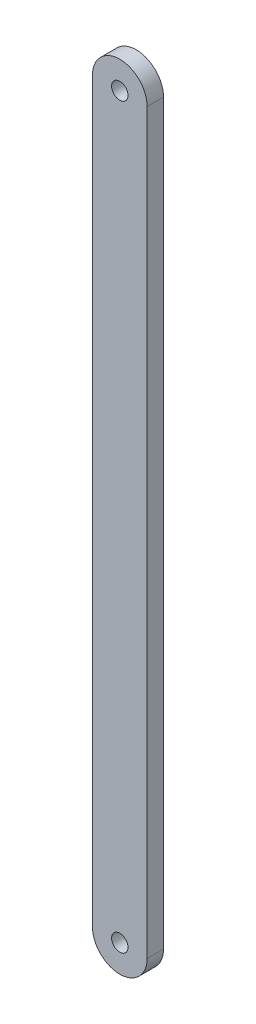
from build123d import *

# Parameters (mm, degrees)
BOSS_EXTRUDE1_DEPTH = 6
SKETCH2_R           = 3
CUT_EXTRUDE1_DEPTH  = 281.242751913


with BuildPart() as part:
    # Sketch1 → Boss-Extrude1 (new body)
    with BuildSketch(Plane.XY):
        with BuildLine():
            Line((-10, 0), (-10, 270))
            ThreePointArc((-10, 270), (0, 280), (10, 270))
            Line((10, 270), (10, 0))
            ThreePointArc((10, 0), (0, -10), (-10, 0))
        make_face()
    extrude(amount=BOSS_EXTRUDE1_DEPTH)

    # Sketch2 → Cut-Extrude1 (cut, through all)
    with BuildSketch(Plane.XY.offset(6)):
        with Locations((0, 270)):
            Circle(SKETCH2_R)
        Circle(SKETCH2_R)
    extrude(amount=-CUT_EXTRUDE1_DEPTH, mode=Mode.SUBTRACT)


solid = part.part
